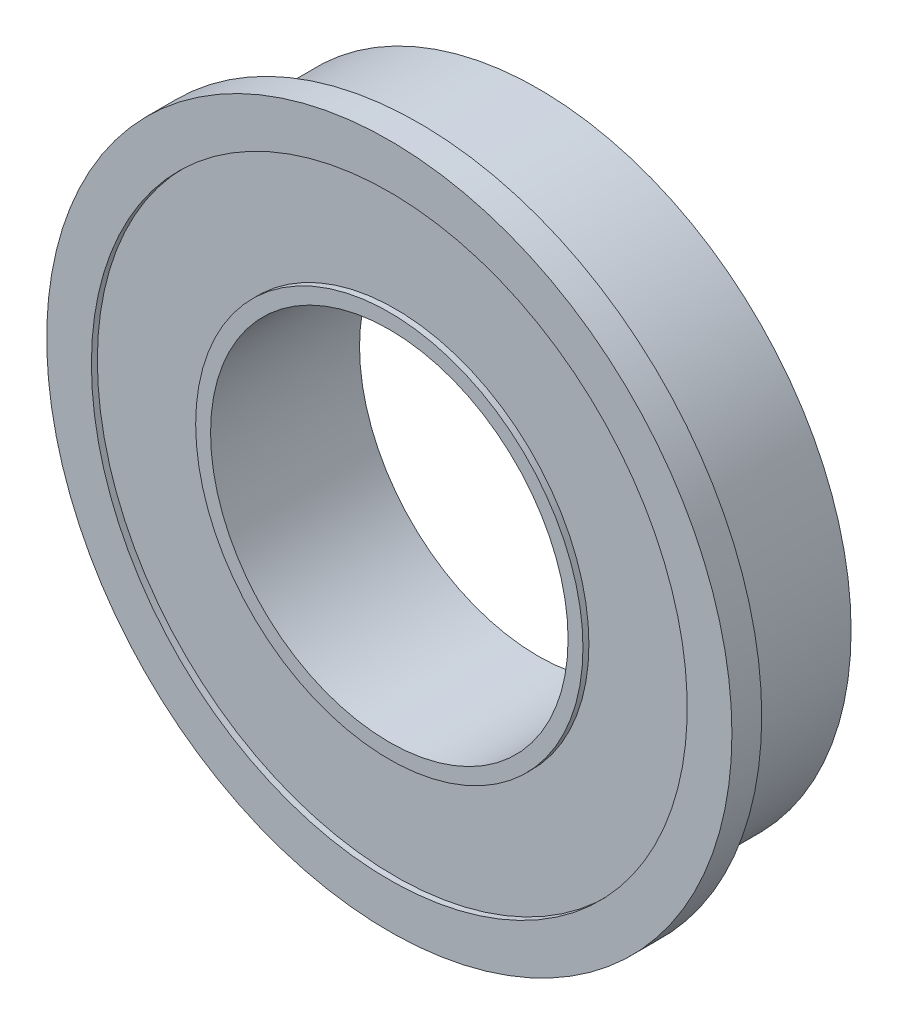
from build123d import *

# Parameters (mm, degrees)
SKETCH_1_R          = 11.5
SKETCH_1_R_2        = 10.5
EXTRUDE_1_DEPTH     = 1
EXTRUDE_START       = -5
SKETCH_2_R          = 10.5
SKETCH_2_R_2        = 6
EXTRUDE_2_DEPTH     = 5
SKETCH_3_R          = 10
SKETCH_3_R_2        = 6.5
CUT_EXTRUDE_1_DEPTH = 0.2


with BuildPart() as part:
    # 草图1 → 凸台-拉伸1 (new body)
    with BuildSketch(Plane.XY):
        Circle(SKETCH_1_R)
        Circle(SKETCH_1_R_2, mode=Mode.SUBTRACT)
    extrude(amount=EXTRUDE_1_DEPTH)

    # 草图2 → 凸台-拉伸2 (add)
    with BuildSketch(Plane.XY.offset(1).offset(EXTRUDE_START)):
        Circle(SKETCH_2_R)
        Circle(SKETCH_2_R_2, mode=Mode.SUBTRACT)
    extrude(amount=EXTRUDE_2_DEPTH)

    # 草图3 → 切除-拉伸1 (cut)
    with BuildSketch(Plane(origin=(0, 0, -4), x_dir=(-1, 0, 0), z_dir=(0, 0, -1))):
        Circle(SKETCH_3_R)
        Circle(SKETCH_3_R_2, mode=Mode.SUBTRACT)
    cut_extrude_1 = extrude(amount=-CUT_EXTRUDE_1_DEPTH, mode=Mode.SUBTRACT)

    # 镜向1: 切除-拉伸1 across plane
    add(cut_extrude_1.mirror(Plane(origin=(0, 0, -1.5), x_dir=(1, 0, 0), z_dir=(0, 0, -1))), mode=Mode.SUBTRACT)


solid = part.part
